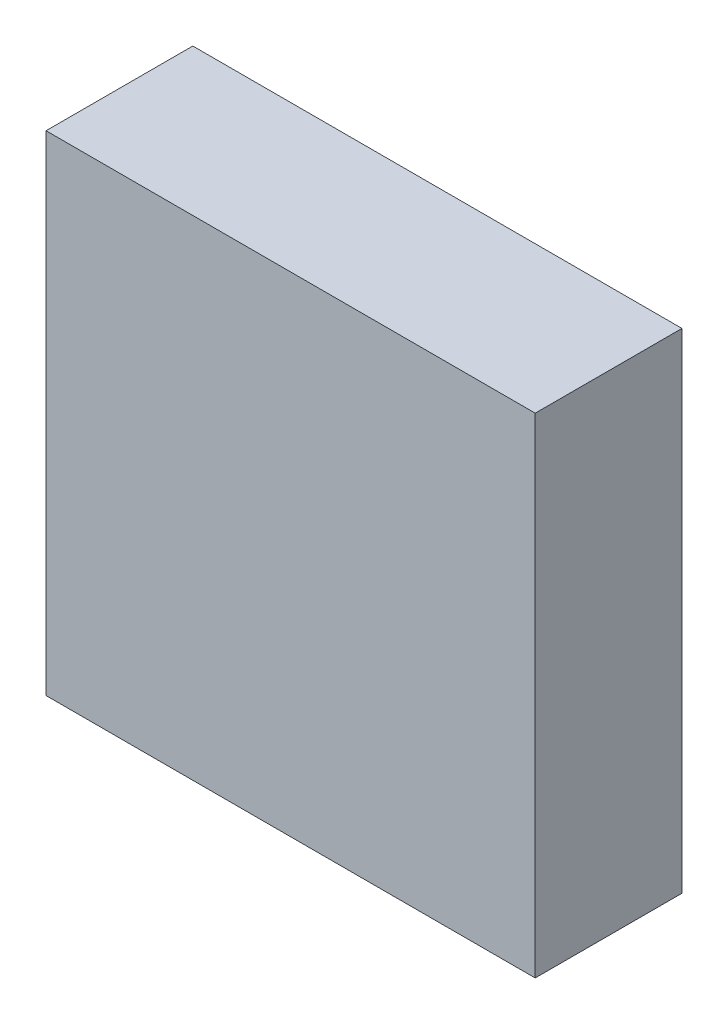
from build123d import *

# Parameters (mm, degrees)
SKETCH_1_W      = 20
SKETCH_1_H      = 20
EXTRUDE_1_DEPTH = 6


with BuildPart() as part:
    # 草圖1 → 填料-伸長1 (new body)
    with BuildSketch(Plane.XY):
        with Locations((2.238758582, 1.057268722)):
            Rectangle(SKETCH_1_W, SKETCH_1_H)
    extrude(amount=EXTRUDE_1_DEPTH)


solid = part.part
